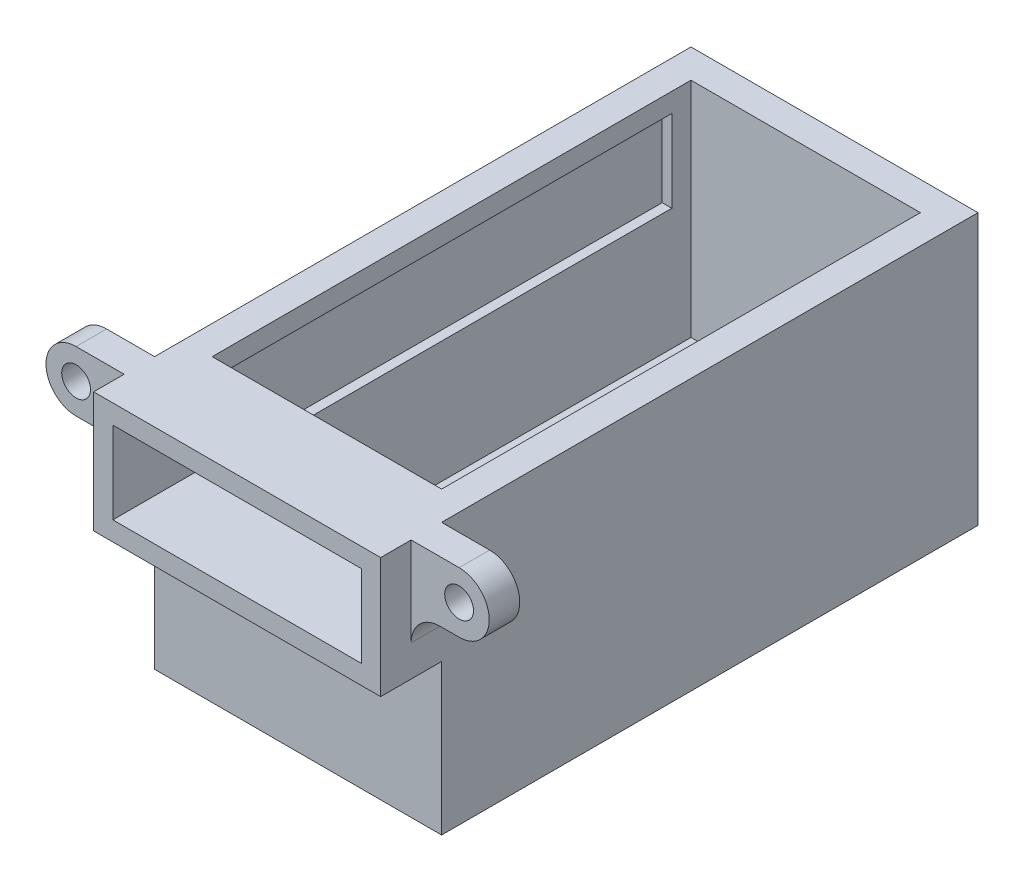
from build123d import *

# Parameters (mm, degrees)
SKETCH1_W           = 29.9
SKETCH1_H           = 12.55
SKETCH1_R           = 1.5
BOSS_EXTRUDE1_DEPTH = 3.175
SKETCH2_W           = 29.9
SKETCH2_H           = 12.55
BOSS_EXTRUDE2_DEPTH = 3.175
BOSS_EXTRUDE3_DEPTH = 55.88
BOSS_EXTRUDE4_DEPTH = 3.175
SKETCH6_W           = 25.9
SKETCH6_H           = 8.55
CUT_EXTRUDE1_DEPTH  = 57.23
SKETCH7_W           = 23.9
SKETCH7_H           = 49.88
CUT_EXTRUDE2_DEPTH  = 23.211


with BuildPart() as part:
    # Sketch1 → Boss-Extrude1 (new body)
    # profile 1 of 3: a face of its own
    with BuildSketch(Plane.XY):
        with Locations((14.95, 6.275)):
            Rectangle(SKETCH1_W, SKETCH1_H)
    # profile 2 of 3: a face of its own
    with BuildSketch(Plane.XY):
        with BuildLine():
            Line((-5, 6.275), (0, 6.275))
            Line((0, 6.275), (0, 12.55))
            Line((0, 12.55), (-5, 12.55))
            ThreePointArc((-5, 12.55), (-8.1375, 9.4125), (-5, 6.275))
        make_face()
        with Locations((-5, 9.4125)):
            Circle(SKETCH1_R, mode=Mode.SUBTRACT)
    # profile 3 of 3: a face of its own
    with BuildSketch(Plane.XY):
        with BuildLine():
            Line((29.9, 12.55), (29.9, 6.275))
            Line((29.9, 6.275), (34.9, 6.275))
            ThreePointArc((34.9, 6.275), (38.0375, 9.4125), (34.9, 12.55))
            Line((34.9, 12.55), (29.9, 12.55))
        make_face()
        with Locations((34.9, 9.4125)):
            Circle(SKETCH1_R, mode=Mode.SUBTRACT)
    extrude(amount=BOSS_EXTRUDE1_DEPTH)

    # Sketch2 → Boss-Extrude2 (add)
    with BuildSketch(Plane.XY.offset(3.175)):
        with Locations((14.95, 6.275)):
            Rectangle(SKETCH2_W, SKETCH2_H)
    extrude(amount=BOSS_EXTRUDE2_DEPTH)

    # Sketch3 → Boss-Extrude3 (add)
    with BuildSketch(Plane(origin=(0, 0, 0), x_dir=(-1, 0, 0), z_dir=(0, 0, -1))):
        Polygon((-29.9, 0), (-29.9, -15.661), (0, -15.661), (0, 12.55), (-29.9, 12.55), align=None)
    extrude(amount=BOSS_EXTRUDE3_DEPTH)

    # Sketch5 → Boss-Extrude4 (add)
    with BuildSketch(Plane.XY.offset(3.175)):
        with BuildLine():
            Line((32.9, 6.275), (29.9, 6.275))
            Line((29.9, 6.275), (29.9, 3.275))
            ThreePointArc((29.9, 3.275), (30.778679656, 5.396320344), (32.9, 6.275))
        make_face()
        with BuildLine():
            Line((0, 6.275), (-3, 6.275))
            ThreePointArc((-3, 6.275), (-0.878679656, 5.396320344), (0, 3.275))
            Line((0, 3.275), (0, 6.275))
        make_face()
    extrude(amount=-BOSS_EXTRUDE4_DEPTH)

    # Sketch6 → Cut-Extrude1 (cut)
    with BuildSketch(Plane.XY.offset(6.35)):
        with Locations((14.95, 6.275)):
            Rectangle(SKETCH6_W, SKETCH6_H)
    extrude(amount=-CUT_EXTRUDE1_DEPTH, mode=Mode.SUBTRACT)

    # Sketch7 → Cut-Extrude2 (cut)
    with BuildSketch(Plane(origin=(0, 12.55, 0), x_dir=(1, 0, 0), z_dir=(0, 1, 0))):
        with Locations((14.95, 27.94)):
            Rectangle(SKETCH7_W, SKETCH7_H)
    extrude(amount=-CUT_EXTRUDE2_DEPTH, mode=Mode.SUBTRACT)


solid = part.part
